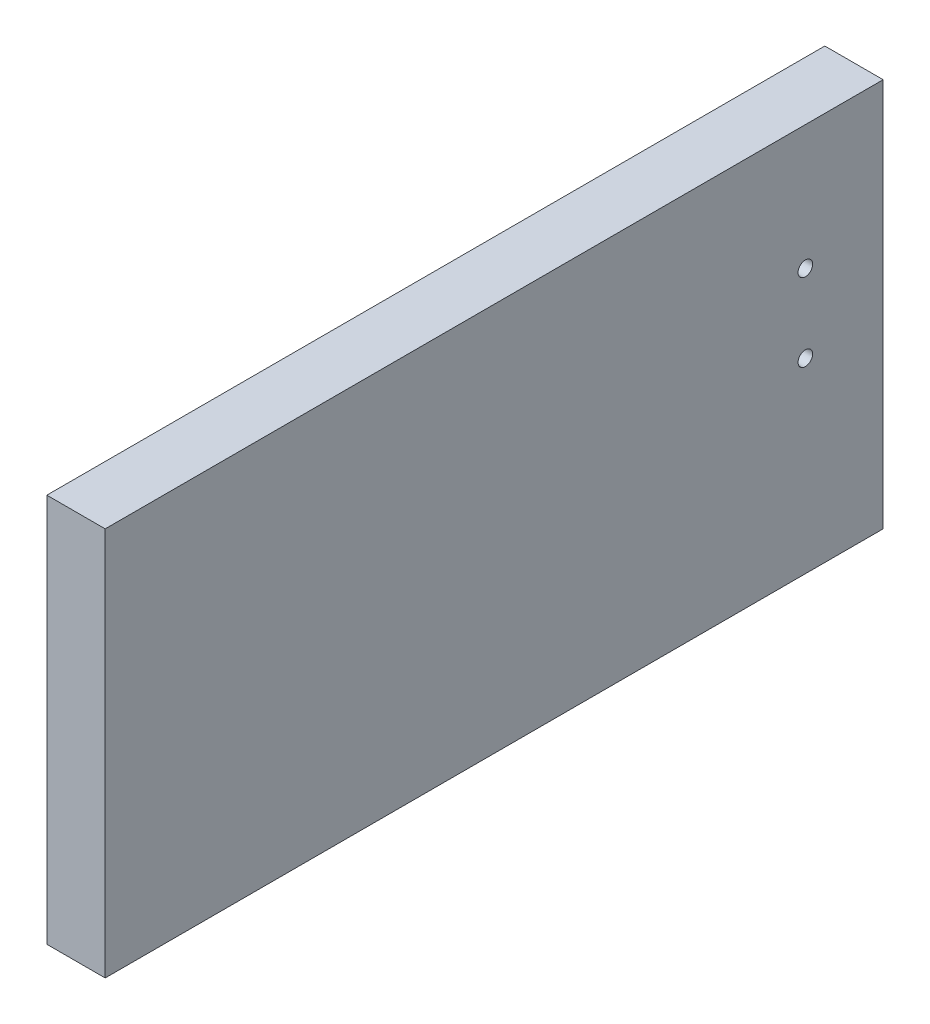
from build123d import *

# Parameters (mm, degrees)
SKETCH1_W           = 19.05
SKETCH1_H           = 127
BOSS_EXTRUDE1_DEPTH = 254
SKETCH2_R           = 2.38125
CUT_EXTRUDE1_DEPTH  = 263.509337929


with BuildPart() as part:
    # Sketch1 → Boss-Extrude1 (new body)
    with BuildSketch(Plane.XY):
        Rectangle(SKETCH1_W, SKETCH1_H)
    extrude(amount=BOSS_EXTRUDE1_DEPTH)

    # Sketch2 → Cut-Extrude1 (cut, through all)
    with BuildSketch(Plane.ZY.offset(9.525)):
        with Locations(Location((25.4, 22.86, 0), (0, 0, 270))):
            Circle(SKETCH2_R)
        with Locations(Location((25.4, -2.54, 0), (0, 0, 270))):
            Circle(SKETCH2_R)
    extrude(amount=-CUT_EXTRUDE1_DEPTH, mode=Mode.SUBTRACT)


solid = part.part
